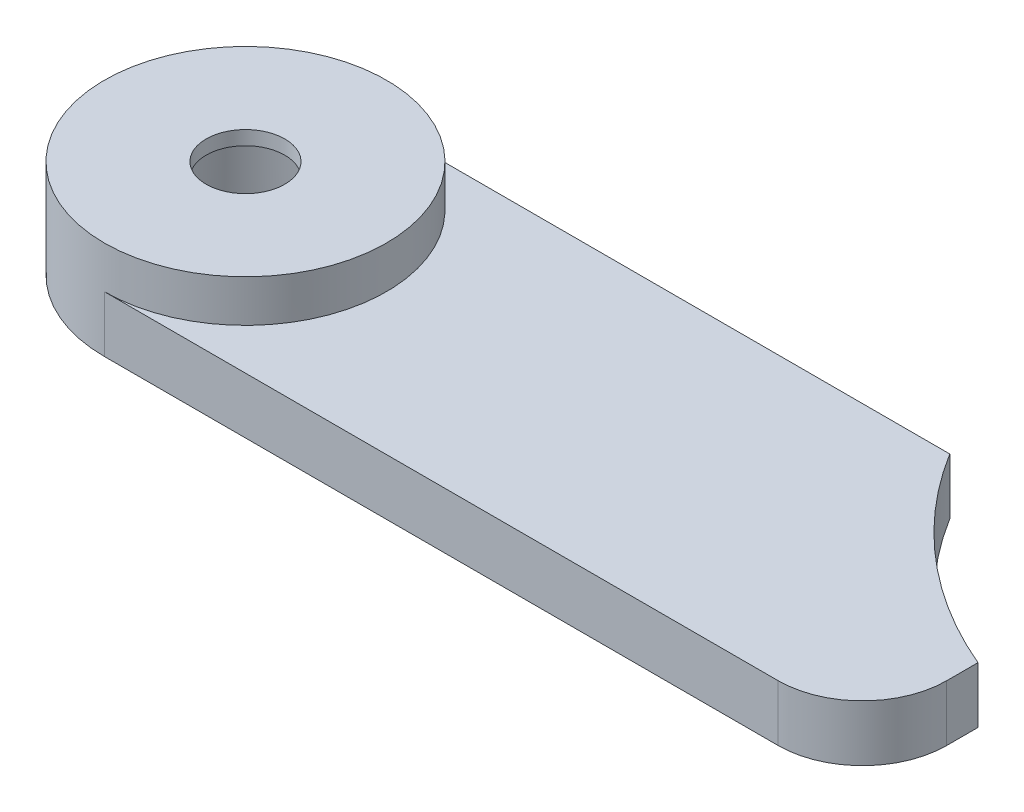
from build123d import *

# Parameters (mm, degrees)
SKETCH1_R           = 5.025
SKETCH1_R_2         = 2.025
BOSS_EXTRUDE1_DEPTH = 3
SKETCH2_W           = 27
SKETCH2_H           = 10.05
BOSS_EXTRUDE2_DEPTH = 2
SKETCH3_R           = 15
CUT_EXTRUDE1_DEPTH  = 2
FILLET1_R           = 3
SKETCH4_R           = 2.5
CUT_EXTRUDE2_DEPTH  = 10
CUT_EXTRUDE2_DRAFT  = 5
SKETCH5_R           = 5.025
BOSS_EXTRUDE3_DEPTH = 0.5
SKETCH6_R           = 1.4
CUT_EXTRUDE3_DEPTH  = 0.5


with BuildPart() as part:
    # Sketch1 → Boss-Extrude1 (new body)
    with BuildSketch(Plane(origin=(0, 0, 0), x_dir=(1, 0, 0), z_dir=(0, 1, 0))):
        with Locations(Location((0, 0, 0), (0, 0, 270))):
            Circle(SKETCH1_R)
        with Locations(Location((0, 0, 0), (0, 0, 270))):
            Circle(SKETCH1_R_2, mode=Mode.SUBTRACT)
    extrude(amount=BOSS_EXTRUDE1_DEPTH)

    # Sketch2 → Boss-Extrude2 (add)
    with BuildSketch(Plane.XZ):
        with Locations((13.5, 0)):
            Rectangle(SKETCH2_W, SKETCH2_H)
    extrude(amount=-BOSS_EXTRUDE2_DEPTH)

    # Sketch3 → Cut-Extrude1 (cut)
    with BuildSketch(Plane(origin=(0, 2, 0), x_dir=(1, 0, 0), z_dir=(0, 1, 0))):
        with Locations((32.816228029, 12.917418084)):
            Circle(SKETCH3_R)
    extrude(amount=-CUT_EXTRUDE1_DEPTH, mode=Mode.SUBTRACT)

    # Fillet1
    fillet1_edges = [part.edges().sort_by_distance(p)[0] for p in [
        (27, 1, 5.025),
    ]]
    fillet(fillet1_edges, radius=FILLET1_R)


with BuildPart() as cut_extrude2_tool:
    # Sketch4 → Cut-Extrude2 (with draft: the straight prism first)
    with BuildSketch(Plane(origin=(0, 3, 0), x_dir=(1, 0, 0), z_dir=(0, 1, 0))):
        Circle(SKETCH4_R)
    extrude(amount=-CUT_EXTRUDE2_DEPTH)
    # Cut-Extrude2: the draft: its side faces are tilted about the plane it starts from
    cut_extrude2_sides = [cut_extrude2_tool.faces().sort_by_distance(p)[0] for p in [
        (-2.5, -2, 0),
    ]]
    draft(cut_extrude2_sides, Plane(origin=(0, 3, 0), x_dir=(1, 0, 0), z_dir=(0, 1, 0)), CUT_EXTRUDE2_DRAFT)


with BuildPart() as part_1:
    add(part.part)

    # Cut-Extrude2: cut by cut_extrude2_tool
    add(cut_extrude2_tool.part, mode=Mode.SUBTRACT)

    # Sketch5 → Boss-Extrude3 (add)
    with BuildSketch(Plane(origin=(0, 3, 0), x_dir=(1, 0, 0), z_dir=(0, 1, 0))):
        with Locations(Location((0, 0, 0), (0, 0, 270))):
            Circle(SKETCH5_R)
    extrude(amount=BOSS_EXTRUDE3_DEPTH)

    # Sketch6 → Cut-Extrude3 (cut)
    with BuildSketch(Plane.XZ.offset(-3)):
        with Locations(Location((0, 0, 0), (0, 0, 270))):
            Circle(SKETCH6_R)
    extrude(amount=-CUT_EXTRUDE3_DEPTH, mode=Mode.SUBTRACT)


solid = part_1.part
